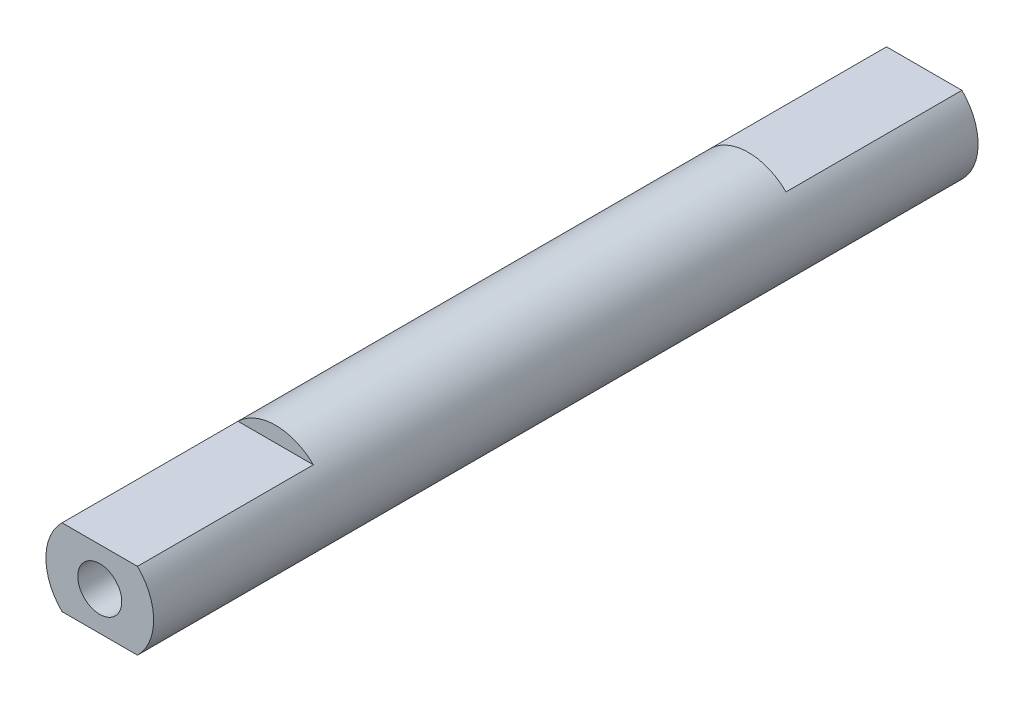
from build123d import *

# Parameters (mm, degrees)
SALIENTE_EXTRUIR1_DEPTH      = 18.75
SALIENTE_EXTRUIR1_DEPTH_BACK = 18.75
CROQUIS1_R                   = 2.45
CROQUIS3_R                   = 1
CORTAR_EXTRUIR1_DEPTH        = 8


with BuildPart() as part:
    # Croquis1 → Saliente-Extruir1 (new, two sides: drawn at the far end of the back side and taken through both)
    with BuildSketch(Plane.XY.offset(-SALIENTE_EXTRUIR1_DEPTH_BACK)):
        Circle(CROQUIS1_R)
    extrude(amount=SALIENTE_EXTRUIR1_DEPTH + SALIENTE_EXTRUIR1_DEPTH_BACK)

    # Croquis3 → Cortar-Extruir1 (cut)
    with BuildSketch(Plane.XY.offset(18.75)):
        Circle(CROQUIS3_R)
        with BuildLine():
            Line((-1.71464282, 1.75), (1.71464282, 1.75))
            ThreePointArc((1.71464282, 1.75), (0, 2.45), (-1.71464282, 1.75))
        make_face()
        with BuildLine():
            Line((-1.71464282, -1.75), (1.71464282, -1.75))
            ThreePointArc((1.71464282, -1.75), (0, -2.45), (-1.71464282, -1.75))
        make_face()
    cortar_extruir1 = extrude(amount=-CORTAR_EXTRUIR1_DEPTH, mode=Mode.SUBTRACT)

    # Simetría1: Cortar-Extruir1 across plane
    add(cortar_extruir1.mirror(Plane.XY), mode=Mode.SUBTRACT)


solid = part.part
